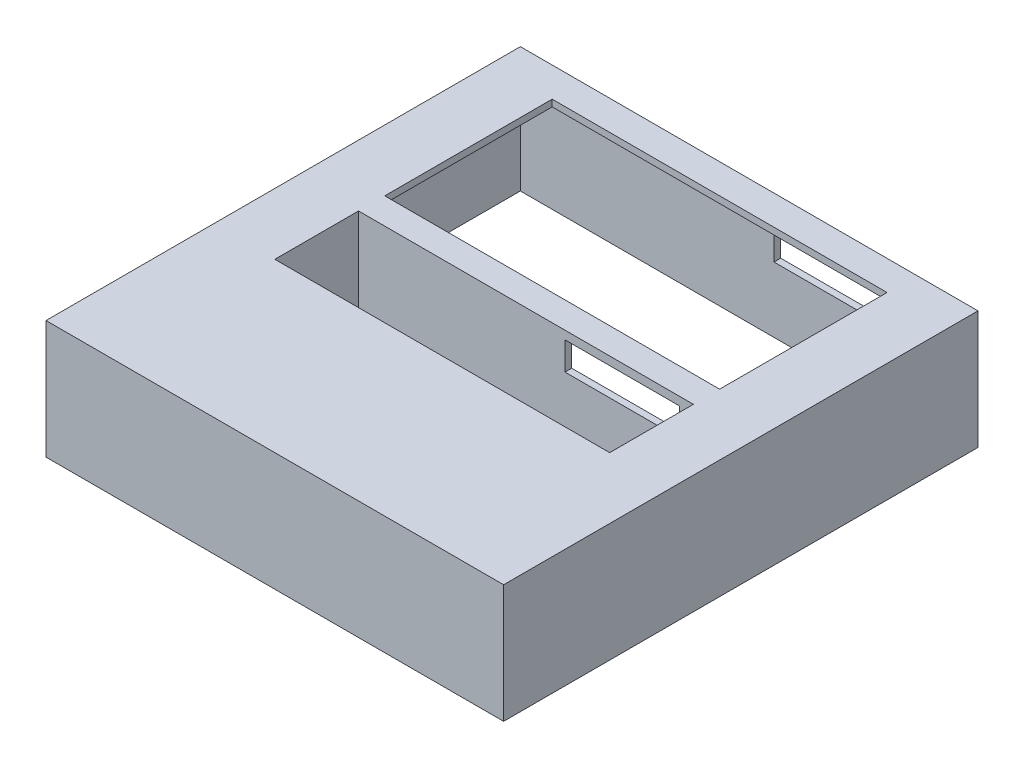
from build123d import *

# Parameters (mm, degrees)
SKETCH1_W           = 82
SKETCH1_H           = 85
BOSS_EXTRUDE1_DEPTH = 1.2
SKETCH2_W           = 60
SKETCH2_H           = 30
CUT_EXTRUDE1_DEPTH  = 2
SKETCH3_W           = 60
SKETCH3_H           = 15
CUT_EXTRUDE2_DEPTH  = 2
SKETCH4_W           = 82
SKETCH4_H           = 85
SKETCH4_W_2         = 79.6
SKETCH4_H_2         = 82.6
BOSS_EXTRUDE2_DEPTH = 20
SKETCH5_W           = 62.4
SKETCH5_H           = 17.4
SKETCH5_W_2         = 60
SKETCH5_H_2         = 15
BOSS_EXTRUDE4_DEPTH = 20
SKETCH10_W          = 1.2
SKETCH10_H          = 3.8
BOSS_EXTRUDE5_DEPTH = 20
SKETCH11_W          = 5
SKETCH11_H          = 11.2
CUT_EXTRUDE3_DEPTH  = 1.5
SKETCH12_W          = 21.5
SKETCH12_H          = 8
CUT_EXTRUDE4_DEPTH  = 1.5
SKETCH15_W          = 20.5
SKETCH15_H          = 5
CUT_EXTRUDE5_DEPTH  = 1.5


with BuildPart() as part:
    # Sketch1 → Boss-Extrude1 (new body)
    with BuildSketch(Plane(origin=(0, 0, 0), x_dir=(1, 0, 0), z_dir=(0, 1, 0))):
        with Locations((41, 42.5)):
            Rectangle(SKETCH1_W, SKETCH1_H)
    extrude(amount=BOSS_EXTRUDE1_DEPTH)

    # Sketch2 → Cut-Extrude1 (cut)
    with BuildSketch(Plane(origin=(0, 1.2, 0), x_dir=(1, 0, 0), z_dir=(0, 1, 0))):
        with Locations((41, 64.7)):
            Rectangle(SKETCH2_W, SKETCH2_H)
    extrude(amount=-CUT_EXTRUDE1_DEPTH, mode=Mode.SUBTRACT)

    # Sketch3 → Cut-Extrude2 (cut)
    with BuildSketch(Plane(origin=(0, 1.2, 0), x_dir=(1, 0, 0), z_dir=(0, 1, 0))):
        with Locations((41, 37.5)):
            Rectangle(SKETCH3_W, SKETCH3_H)
    extrude(amount=-CUT_EXTRUDE2_DEPTH, mode=Mode.SUBTRACT)

    # Sketch4 → Boss-Extrude2 (add)
    with BuildSketch(Plane.XZ):
        with Locations((41, -42.5)):
            Rectangle(SKETCH4_W, SKETCH4_H)
        with Locations((41, -42.5)):
            Rectangle(SKETCH4_W_2, SKETCH4_H_2, mode=Mode.SUBTRACT)
    extrude(amount=BOSS_EXTRUDE2_DEPTH)

    # Sketch5 → Boss-Extrude4 (add)
    with BuildSketch(Plane.XZ):
        with Locations((41, -37.5)):
            Rectangle(SKETCH5_W, SKETCH5_H)
        with Locations((41, -37.5)):
            Rectangle(SKETCH5_W_2, SKETCH5_H_2, mode=Mode.SUBTRACT)
    extrude(amount=BOSS_EXTRUDE4_DEPTH)

    # Sketch10 → Boss-Extrude5 (add)
    with BuildSketch(Plane.XZ):
        with Locations((9.8, -26.9)):
            Rectangle(SKETCH10_W, SKETCH10_H)
    extrude(amount=BOSS_EXTRUDE5_DEPTH)

    # Sketch11 → Cut-Extrude3 (cut)
    with BuildSketch(Plane.ZY):
        with Locations((-24.5, -9.4)):
            Rectangle(SKETCH11_W, SKETCH11_H)
    extrude(amount=-CUT_EXTRUDE3_DEPTH, mode=Mode.SUBTRACT)

    # Sketch12 → Cut-Extrude4 (cut)
    with BuildSketch(Plane(origin=(0, 0, -85), x_dir=(-1, 0, 0), z_dir=(0, 0, -1))):
        with Locations((-57.4, -4.3)):
            Rectangle(SKETCH12_W, SKETCH12_H)
    extrude(amount=-CUT_EXTRUDE4_DEPTH, mode=Mode.SUBTRACT)

    # Sketch15 → Cut-Extrude5 (cut)
    with BuildSketch(Plane.XY.offset(-45)):
        with Locations((58.25, -2.8)):
            Rectangle(SKETCH15_W, SKETCH15_H)
    extrude(amount=-CUT_EXTRUDE5_DEPTH, mode=Mode.SUBTRACT)


solid = part.part
